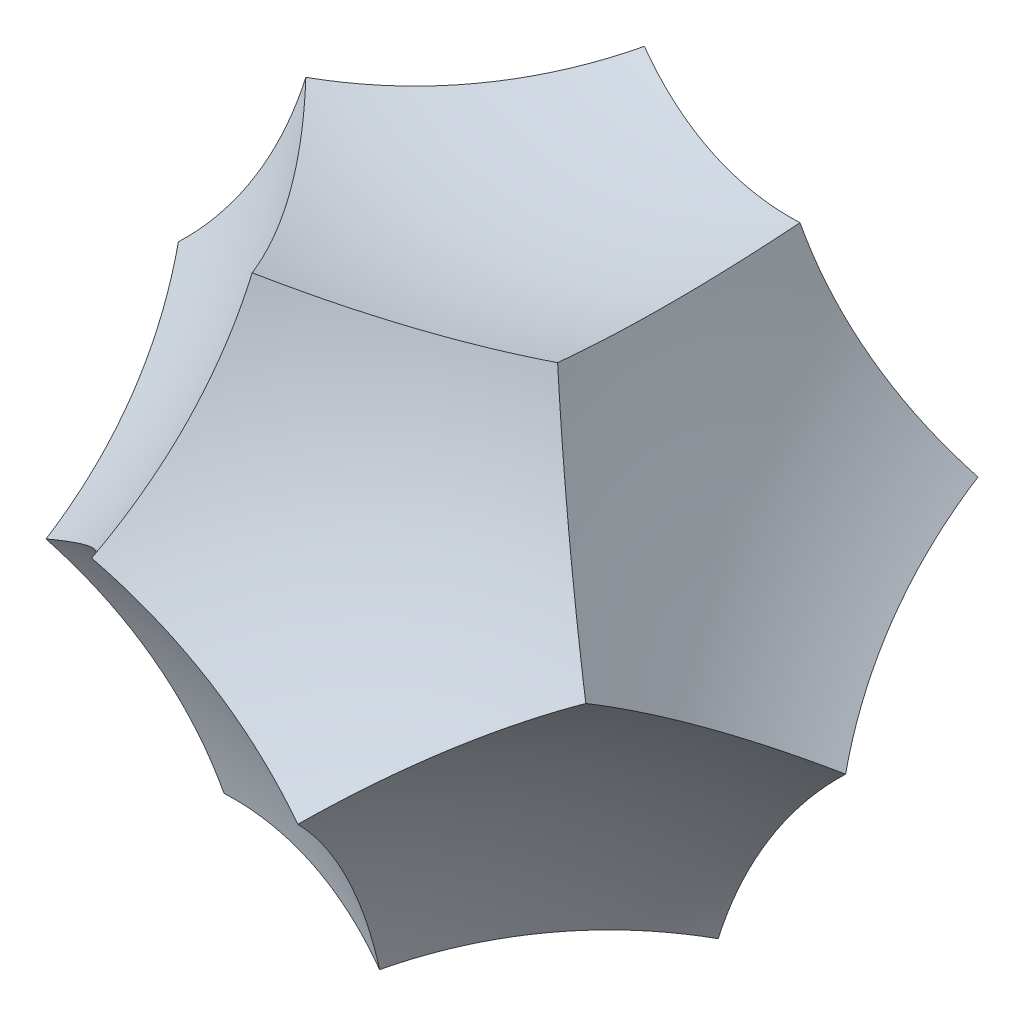
from build123d import *

# Parameters (mm, degrees)
CIRPATTERN1_COUNT = 2
CIRPATTERN1_ANGLE = 116.565051177


with BuildPart() as part:
    # Sketch1 → Revolve1 (revolve)
    with BuildSketch(Plane(origin=(0, 0, 0), x_dir=(1, 0, 0), z_dir=(0, 1, 0))):
        with BuildLine():
            Line((0, -100), (0, 100))
            ThreePointArc((0, 100), (100, 0), (0, -100))
        make_face()
    revolve(axis=Axis((0, 0, 100), (0, 0, -1)))

    # Sketch2 → Cut-Revolve1 (revolve, cut)
    with BuildSketch(Plane.XY):
        with BuildLine():
            Line((0, 245.843235607), (0, 36.168568135))
            ThreePointArc((0, 36.168568135), (-104.837333736, 141.005901871), (0, 245.843235607))
        make_face()
    cut_revolve1 = revolve(axis=Axis((0, 245.843235607, 0), (0, -1, 0)), mode=Mode.SUBTRACT)

    # Mirror1: Cut-Revolve1 across plane
    add(cut_revolve1.mirror(Plane.ZX), mode=Mode.SUBTRACT)

    # CirPattern1: Cut-Revolve1 ×2 about axis
    cirpattern1_axis = Axis((0, 0, -110), (0, 0, 1))
    for i in range(1, CIRPATTERN1_COUNT):
        add(cut_revolve1.rotate(cirpattern1_axis, i * CIRPATTERN1_ANGLE / (CIRPATTERN1_COUNT - 1)), mode=Mode.SUBTRACT)

    # CirPattern1 copy 1 sketch → CirPattern1 copy 1 (revolve, cut)
    with BuildSketch(Plane(origin=(0, 0, 0), x_dir=(-0.44721359549996187, 0.8944271909999139, 0), z_dir=(0, 0, 1))):
        with BuildLine():
            Line((0, -245.843235607), (0, -36.168568135))
            ThreePointArc((0, -36.168568135), (-104.837333736, -141.005901871), (0, -245.843235607))
        make_face()
    revolve(axis=Axis((219.888874651, 109.944437325, 0), (0.894427190999914, 0.4472135954999616, 0)), mode=Mode.SUBTRACT)

    # CirPattern2 copy 1 sketch → CirPattern2 copy 1 (revolve, cut)
    with BuildSketch(Plane(origin=(0, 0, 0), x_dir=(-0.13819660112501175, 0.8944271909999139, -0.42532540417602366), z_dir=(-0.9510565162951535, 0, 0.30901699437494745))):
        with BuildLine():
            Line((0, 245.843235607), (0, 36.168568135))
            ThreePointArc((0, 36.168568135), (-104.837333736, 141.005901871), (0, 245.843235607))
        make_face()
    revolve(axis=Axis((-67.949399141, -109.944437325, -209.126747097), (0.2763932022500204, 0.44721359549996215, 0.8506508083520379)), mode=Mode.SUBTRACT)

    # CirPattern2 copy 2 sketch → CirPattern2 copy 2 (revolve, cut)
    with BuildSketch(Plane(origin=(0, 0, 0), x_dir=(0.36180339887499263, 0.8944271909999139, -0.2628655560595692), z_dir=(-0.5877852522924732, 0, -0.8090169943749473))):
        with BuildLine():
            Line((0, 245.843235607), (0, 36.168568135))
            ThreePointArc((0, 36.168568135), (-104.837333736, 141.005901871), (0, 245.843235607))
        make_face()
    revolve(axis=Axis((177.893836466, -109.944437325, -129.247437663), (-0.7236067977499772, 0.44721359549996215, 0.5257311121191324)), mode=Mode.SUBTRACT)

    # CirPattern2 copy 3 sketch → CirPattern2 copy 3 (revolve, cut)
    with BuildSketch(Plane(origin=(0, 0, 0), x_dir=(0.36180339887499274, 0.8944271909999137, 0.26286555605956907), z_dir=(0.587785252292473, 0, -0.8090169943749476))):
        with BuildLine():
            Line((0, 245.843235607), (0, 36.168568135))
            ThreePointArc((0, 36.168568135), (-104.837333736, 141.005901871), (0, 245.843235607))
        make_face()
    revolve(axis=Axis((177.893836466, -109.944437325, 129.247437663), (-0.7236067977499774, 0.4472135954999621, -0.5257311121191323)), mode=Mode.SUBTRACT)

    # CirPattern2 copy 4 sketch → CirPattern2 copy 4 (revolve, cut)
    with BuildSketch(Plane(origin=(0, 0, 0), x_dir=(-0.13819660112501164, 0.8944271909999139, 0.4253254041760237), z_dir=(0.9510565162951536, 0, 0.30901699437494723))):
        with BuildLine():
            Line((0, 245.843235607), (0, 36.168568135))
            ThreePointArc((0, 36.168568135), (-104.837333736, 141.005901871), (0, 245.843235607))
        make_face()
    revolve(axis=Axis((-67.949399141, -109.944437325, 209.126747097), (0.2763932022500202, 0.44721359549996215, -0.850650808352038)), mode=Mode.SUBTRACT)

    # CirPattern2 copy 5 sketch → CirPattern2 copy 5 (revolve, cut)
    with BuildSketch(Plane(origin=(0, 0, 0), x_dir=(-0.13819660112501175, 0.8944271909999139, -0.42532540417602366), z_dir=(-0.9510565162951535, 0, 0.30901699437494745))):
        with BuildLine():
            Line((0, -245.843235607), (0, -36.168568135))
            ThreePointArc((0, -36.168568135), (-104.837333736, -141.005901871), (0, -245.843235607))
        make_face()
    revolve(axis=Axis((67.949399141, 109.944437325, 209.126747097), (0.2763932022500205, 0.4472135954999616, 0.8506508083520381)), mode=Mode.SUBTRACT)

    # CirPattern2 copy 6 sketch → CirPattern2 copy 6 (revolve, cut)
    with BuildSketch(Plane(origin=(0, 0, 0), x_dir=(0.36180339887499263, 0.8944271909999139, -0.2628655560595692), z_dir=(-0.5877852522924732, 0, -0.8090169943749473))):
        with BuildLine():
            Line((0, -245.843235607), (0, -36.168568135))
            ThreePointArc((0, -36.168568135), (-104.837333736, -141.005901871), (0, -245.843235607))
        make_face()
    revolve(axis=Axis((-177.893836466, 109.944437325, 129.247437663), (-0.7236067977499774, 0.4472135954999616, 0.5257311121191326)), mode=Mode.SUBTRACT)

    # CirPattern2 copy 7 sketch → CirPattern2 copy 7 (revolve, cut)
    with BuildSketch(Plane(origin=(0, 0, 0), x_dir=(0.36180339887499274, 0.8944271909999137, 0.26286555605956907), z_dir=(0.587785252292473, 0, -0.8090169943749476))):
        with BuildLine():
            Line((0, -245.843235607), (0, -36.168568135))
            ThreePointArc((0, -36.168568135), (-104.837333736, -141.005901871), (0, -245.843235607))
        make_face()
    revolve(axis=Axis((-177.893836466, 109.944437325, -129.247437663), (-0.7236067977499776, 0.44721359549996154, -0.5257311121191325)), mode=Mode.SUBTRACT)

    # CirPattern2 copy 8 sketch → CirPattern2 copy 8 (revolve, cut)
    with BuildSketch(Plane(origin=(0, 0, 0), x_dir=(-0.13819660112501164, 0.8944271909999139, 0.4253254041760237), z_dir=(0.9510565162951536, 0, 0.30901699437494723))):
        with BuildLine():
            Line((0, -245.843235607), (0, -36.168568135))
            ThreePointArc((0, -36.168568135), (-104.837333736, -141.005901871), (0, -245.843235607))
        make_face()
    revolve(axis=Axis((67.949399141, 109.944437325, -209.126747097), (0.2763932022500203, 0.4472135954999616, -0.8506508083520382)), mode=Mode.SUBTRACT)

    # CirPattern2 copy 9 sketch → CirPattern2 copy 9 (revolve, cut)
    with BuildSketch(Plane(origin=(0, 0, 0), x_dir=(0.30901699437494745, 0, 0.9510565162951535), z_dir=(-0.9510565162951535, 0, 0.30901699437494745))):
        with BuildLine():
            Line((0, 245.843235607), (0, 36.168568135))
            ThreePointArc((0, 36.168568135), (-104.837333736, 141.005901871), (0, 245.843235607))
        make_face()
    revolve(axis=Axis((0, 245.843235607, 0), (0, -1, 0)), mode=Mode.SUBTRACT)

    # CirPattern2 copy 10 sketch → CirPattern2 copy 10 (revolve, cut)
    with BuildSketch(Plane(origin=(0, 0, 0), x_dir=(-0.8090169943749473, 0, 0.5877852522924732), z_dir=(-0.5877852522924732, 0, -0.8090169943749473))):
        with BuildLine():
            Line((0, 245.843235607), (0, 36.168568135))
            ThreePointArc((0, 36.168568135), (-104.837333736, 141.005901871), (0, 245.843235607))
        make_face()
    revolve(axis=Axis((0, 245.843235607, 0), (0, -1, 0)), mode=Mode.SUBTRACT)

    # CirPattern2 copy 11 sketch → CirPattern2 copy 11 (revolve, cut)
    with BuildSketch(Plane(origin=(0, 0, 0), x_dir=(-0.8090169943749476, 0, -0.587785252292473), z_dir=(0.587785252292473, 0, -0.8090169943749476))):
        with BuildLine():
            Line((0, 245.843235607), (0, 36.168568135))
            ThreePointArc((0, 36.168568135), (-104.837333736, 141.005901871), (0, 245.843235607))
        make_face()
    revolve(axis=Axis((0, 245.843235607, 0), (0, -1, 0)), mode=Mode.SUBTRACT)

    # CirPattern2 copy 12 sketch → CirPattern2 copy 12 (revolve, cut)
    with BuildSketch(Plane(origin=(0, 0, 0), x_dir=(0.30901699437494723, 0, -0.9510565162951536), z_dir=(0.9510565162951536, 0, 0.30901699437494723))):
        with BuildLine():
            Line((0, 245.843235607), (0, 36.168568135))
            ThreePointArc((0, 36.168568135), (-104.837333736, 141.005901871), (0, 245.843235607))
        make_face()
    revolve(axis=Axis((0, 245.843235607, 0), (0, -1, 0)), mode=Mode.SUBTRACT)


solid = part.part
